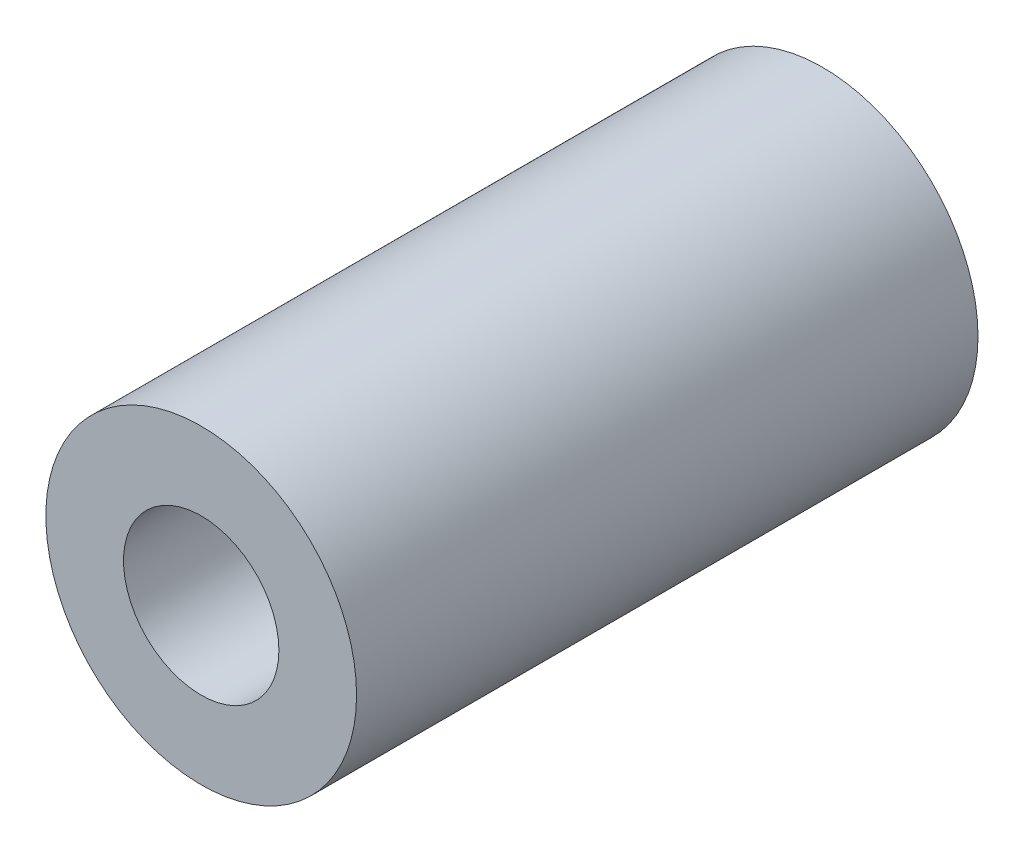
from build123d import *

# Parameters (mm, degrees)
SKETCH1_R     = 4
SKETCH1_R_2   = 2
PROFILE_DEPTH = 16


with BuildPart() as part:
    # Sketch1 → Profile (new body)
    with BuildSketch(Plane.XY):
        with Locations((4, 4)):
            Circle(SKETCH1_R)
        with Locations((4, 4)):
            Circle(SKETCH1_R_2, mode=Mode.SUBTRACT)
    extrude(amount=PROFILE_DEPTH)


solid = part.part
